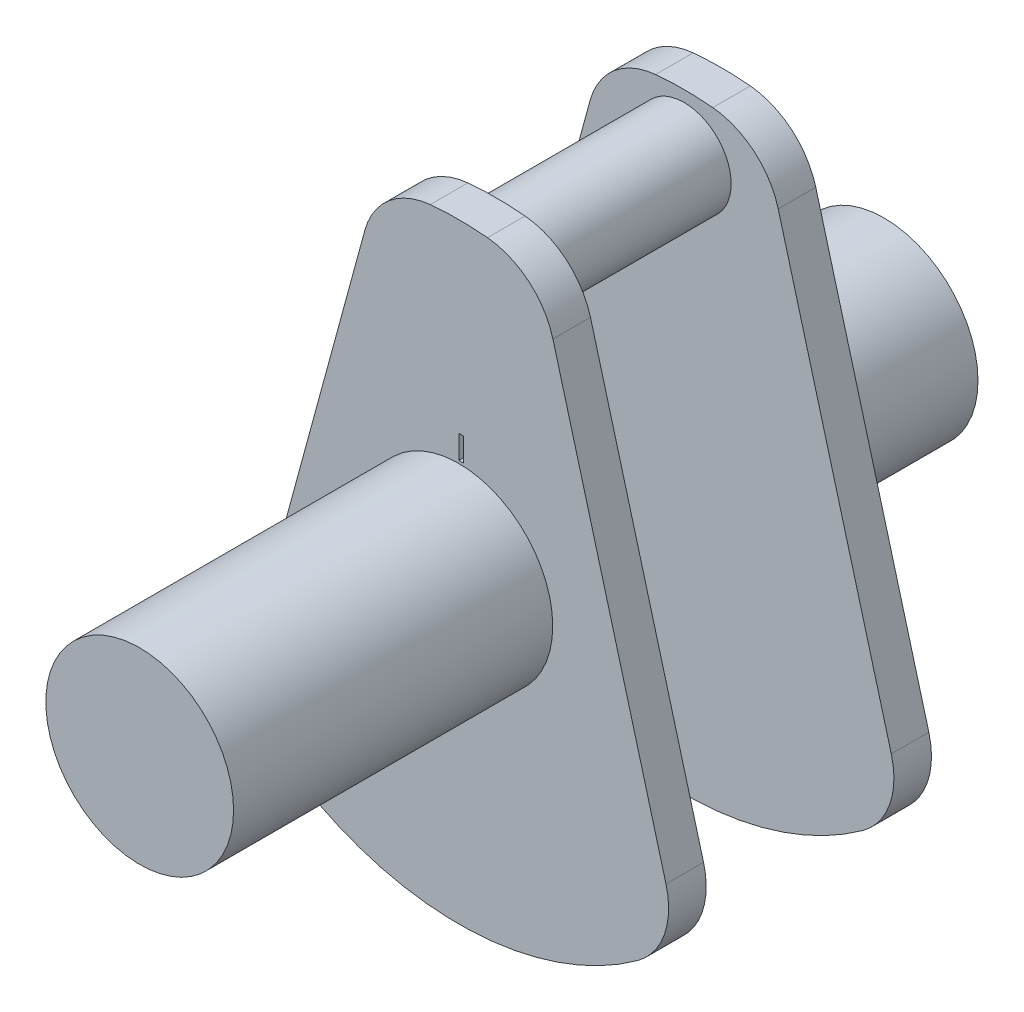
from build123d import *

# Parameters (mm, degrees)
BOSS_EXTRUDE1_DEPTH = 0.8
SKETCH3_R           = 1
BOSS_EXTRUDE2_DEPTH = 2
SKETCH4_R           = 2
BOSS_EXTRUDE3_DEPTH = 3.46
SKETCH5_R           = 2
BOSS_EXTRUDE4_DEPTH = 3.34
SKETCH6_W           = 0.1
SKETCH6_H           = 0.5
CUT_EXTRUDE1_DEPTH  = 0.1


with BuildPart() as part:
    # Sketch1 → Boss-Extrude1 (new body)
    with BuildSketch(Plane.XY):
        with BuildLine():
            Line((-2.003843202, 5.298536735), (-4.412682198, -3.552198604))
            ThreePointArc((-4.412682198, -3.552198604), (-4.377352827, -4.505653519), (-3.805602751, -5.269476986))
            ThreePointArc((-3.805602751, -5.269476986), (0, -6.5), (3.805602751, -5.269476986))
            ThreePointArc((3.805602751, -5.269476986), (4.377352827, -4.505653519), (4.412682198, -3.552198604))
            Line((4.412682198, -3.552198604), (2.003843202, 5.298536735))
            ThreePointArc((2.003843202, 5.298536735), (1.490188902, 6.102578835), (0.610204082, 6.471294382))
            ThreePointArc((0.610204082, 6.471294382), (0, 6.5), (-0.610204082, 6.471294382))
            ThreePointArc((-0.610204082, 6.471294382), (-1.490188902, 6.102578835), (-2.003843202, 5.298536735))
        make_face()
    extrude(amount=BOSS_EXTRUDE1_DEPTH)

    # Sketch3 → Boss-Extrude2 (add)
    with BuildSketch(Plane.XY.offset(0.8)):
        with Locations((0, 5.26)):
            Circle(SKETCH3_R)
    extrude(amount=BOSS_EXTRUDE2_DEPTH)

    # Sketch4 → Boss-Extrude3 (add)
    with BuildSketch(Plane(origin=(0, 0, 0), x_dir=(-1, 0, 0), z_dir=(0, 0, -1))):
        with Locations(Location((0, 0, 0), (0, 0, 180))):
            Circle(SKETCH4_R)
    extrude(amount=BOSS_EXTRUDE3_DEPTH)

    # Mirror1: part across plane


with BuildPart() as part_1:
    add(part.part)
    add(part.part.mirror(Plane(origin=(0, 5.26, 2.8), x_dir=(1, 0, 0), z_dir=(0, 0, 1))))

    # Sketch5 → Boss-Extrude4 (add)
    with BuildSketch(Plane.XY.offset(9.06)):
        Circle(SKETCH5_R)
    extrude(amount=BOSS_EXTRUDE4_DEPTH)

    # Sketch6 → Cut-Extrude1 (cut)
    with BuildSketch(Plane.XY.offset(5.6)):
        with Locations((0.05, 2.306226831)):
            Rectangle(SKETCH6_W, SKETCH6_H)
    extrude(amount=-CUT_EXTRUDE1_DEPTH, mode=Mode.SUBTRACT)


solid = part_1.part
